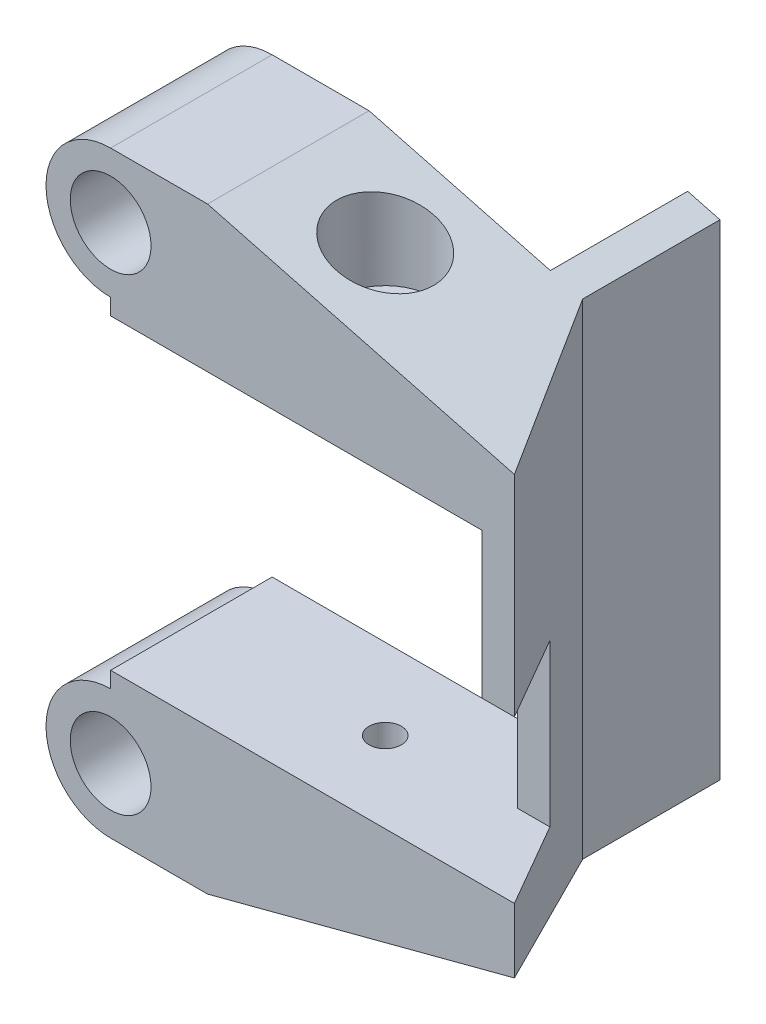
from build123d import *

# Parameters (mm, degrees)
CROQUIS1_R              = 2.5
SALIENTE_EXTRUIR1_DEPTH = 10
CROQUIS2_R              = 1
CORTAR_EXTRUIR1_DEPTH   = 4
SALIENTE_EXTRUIR2_DEPTH = 13.5
CROQUIS4_R              = 3
CORTAR_EXTRUIR2_DEPTH   = 1
SALIENTE_EXTRUIR3_START = 5
CROQUIS6_R              = 3
SALIENTE_EXTRUIR3_DEPTH = 5
CORTAR_EXTRUIR3_DEPTH   = 10
SALIENTE_EXTRUIR4_DEPTH = 8.5
CROQUIS5_W              = 2
CROQUIS5_H              = 10
CORTAR_EXTRUIR4_DEPTH   = 6


with BuildPart() as part:
    # Croquis1 → Saliente-Extruir1 (new body)
    with BuildSketch(Plane.XY):
        with BuildLine():
            Line((-106.231635218, 22.700651543), (-131.231635218, 22.700651543))
            Line((-131.231635218, 22.700651543), (-131.231635218, 21.700651543))
            ThreePointArc((-131.231635218, 21.700651543), (-135.231635218, 17.700651543), (-131.231635218, 13.700651543))
            Line((-131.231635218, 13.700651543), (-125.231635218, 13.700651543))
            Line((-125.231635218, 13.700651543), (-125.231635218, 18.700651543))
            Line((-125.231635218, 18.700651543), (-106.231635218, 18.700651543))
            Line((-106.231635218, 18.700651543), (-106.231635218, 22.700651543))
        make_face()
        with Locations((-131.231635218, 17.700651543)):
            Circle(CROQUIS1_R, mode=Mode.SUBTRACT)
    extrude(amount=SALIENTE_EXTRUIR1_DEPTH)

    # Croquis2 → Cortar-Extruir1 (cut)
    with BuildSketch(Plane.XZ.offset(-18.700651543)):
        with Locations(Location((-119.231635218, 5, 0), (0, 0, 270))):
            Circle(CROQUIS2_R)
        Polygon((-106.231635218, 0), (-106.231635218, 10), (-112.00513791, 0), align=None)
    extrude(amount=-CORTAR_EXTRUIR1_DEPTH, mode=Mode.SUBTRACT)

    # Croquis3 → Saliente-Extruir2 (add)
    with BuildSketch(Plane.XZ.offset(-18.700651543)):
        Polygon((-106.231635218, 10), (-108.231635218, 10), (-114.00513791, 0), (-112.00513791, 0), align=None)
    extrude(amount=-SALIENTE_EXTRUIR2_DEPTH)

    # Croquis4 → Cortar-Extruir2 (cut)
    with BuildSketch(Plane.XZ.offset(-18.700651543)):
        with Locations(Location((-119.231635218, 5, 0), (0, 0, 270))):
            Circle(CROQUIS4_R)
    extrude(amount=-CORTAR_EXTRUIR2_DEPTH, mode=Mode.SUBTRACT)

    # Croquis6 → Saliente-Extruir3 (add)
    with BuildSketch(Plane.XZ.offset(-18.700651543).offset(SALIENTE_EXTRUIR3_START)):
        Polygon((-106.231635218, 10), (-125.231635218, 10), (-125.231635218, 0), (-112.00513791, 0), align=None)
        with Locations(Location((-119.231635218, 5, 0), (0, 0, 270))):
            Circle(CROQUIS6_R, mode=Mode.SUBTRACT)
    extrude(amount=-SALIENTE_EXTRUIR3_DEPTH)

    # Croquis7 → Cortar-Extruir3 (cut)
    with BuildSketch(Plane.XY.offset(10)):
        Polygon((-106.231635218, 18.700651543), (-106.231635218, 13.700651543), (-125.231635218, 13.700651543), align=None)
    extrude(amount=-CORTAR_EXTRUIR3_DEPTH, mode=Mode.SUBTRACT)

    # Croquis8 → Saliente-Extruir4 (add)
    with BuildSketch(Plane(origin=(0, 0, 0), x_dir=(-1, 0, 0), z_dir=(0, 0, -1))):
        Polygon((112.00513791, 17.181308729), (112.00513791, 32.200651543), (114.00513791, 32.200651543), (114.00513791, 16.65499294), align=None)
    extrude(amount=SALIENTE_EXTRUIR4_DEPTH)

    # Simetría1: part across plane


with BuildPart() as part_1:
    add(part.part)
    add(part.part.mirror(Plane(origin=(0, 32.200651543, 0), x_dir=(0, 0, 1), z_dir=(0, -1, 0))))

    # Croquis5 → Cortar-Extruir4 (cut, along a direction that is not the sketch's normal)
    with BuildSketch(Plane.XY.offset(10)):
        with Locations((-107.231635218, 27.700651543)):
            Rectangle(CROQUIS5_W, CROQUIS5_H)
    extrude(amount=-CORTAR_EXTRUIR4_DEPTH, dir=(0.49999999999999506, 0, 0.8660254037844416), mode=Mode.SUBTRACT)


solid = part_1.part
